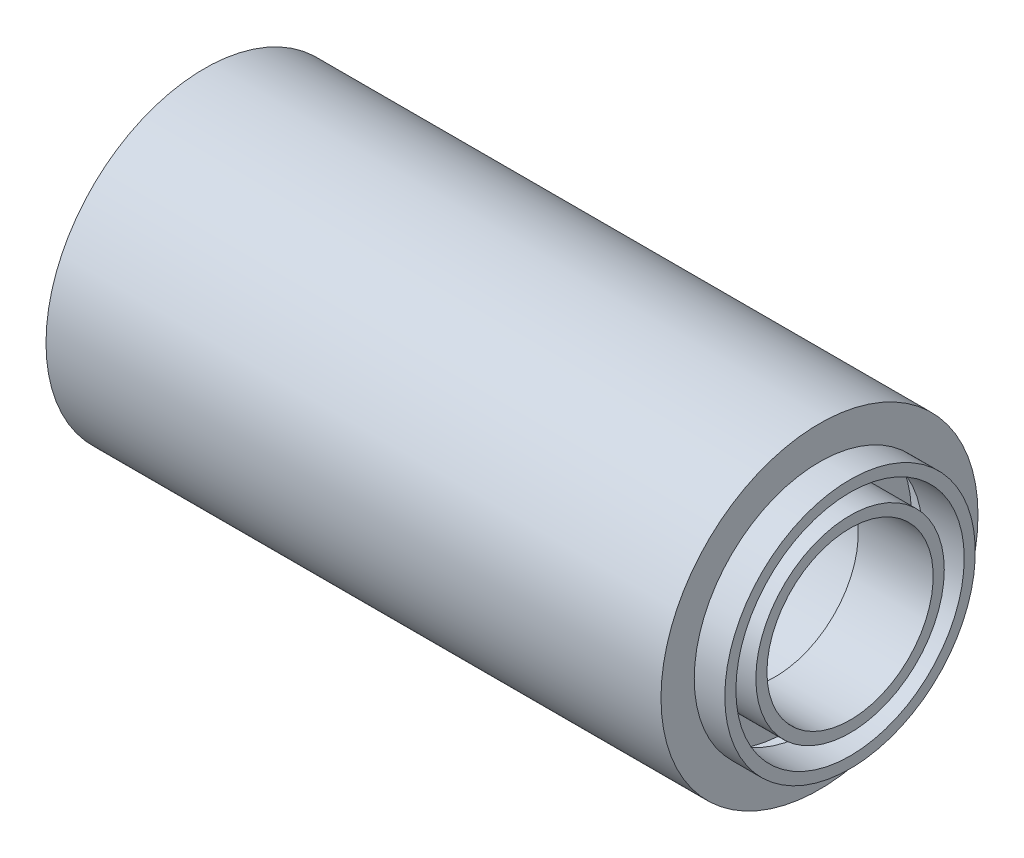
from build123d import *


with BuildPart() as part:
    # Sketch1 → Revolve1 (revolve)
    with BuildSketch(Plane.XY, mode=Mode.PRIVATE) as revolve1_sk:
        Polygon((140.309357349, 21.59), (125.68467097, 21.59), (125.68467097, 28.702), (0, 28.702), (0, 21.59), (-12.090642651, 21.59), (-12.090642651, 19.05), (2.54, 19.05), (2.54, 26.162), (123.14467097, 26.162), (123.14467097, 19.05), (140.309357349, 19.05), align=None)
        Polygon((-5.08, 33.782), (130.76467097, 33.782), (130.76467097, 26.162), (140.309357349, 26.162), (140.309357349, 28.702), (133.30467097, 28.702), (133.30467097, 36.322), (-7.62, 36.322), (-7.62, 28.702), (-12.090642651, 28.702), (-12.090642651, 26.162), (-5.08, 26.162), align=None)
    revolve(revolve1_sk.sketch.rotate(Axis((0, 0, 0), (1, 0, 0)), 90), axis=Axis((0, 0, 0), (1, 0, 0)))


solid = part.part
